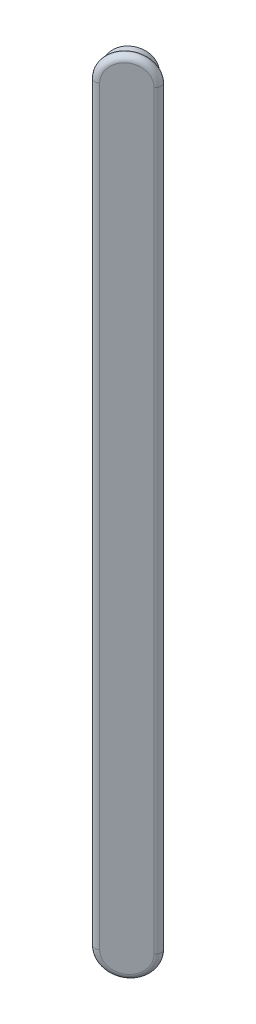
from build123d import *

# Parameters (mm, degrees)
BOSS_EXTRUDE1_DEPTH = 1.499997834
BOSS_EXTRUDE2_DEPTH = 2.999998821
CUT_EXTRUDE1_DEPTH  = 2.999999995
FILLET1_R           = 1.400201404
BOSS_EXTRUDE3_REACH = 8499.621
SKETCH4_W           = 6.8
SKETCH4_H           = 1


with BuildPart() as part:
    # Sketch1 → Boss-Extrude1 (new body)
    with BuildSketch(Plane(origin=(-3679.783466787, -3e-09, -4864.000529017), x_dir=(0, -1, 0), z_dir=(-0.6033298825291362, -4.862971078225009e-13, -0.7974917258801991))):
        with BuildLine():
            Line((-531.630972559, 8466.305810109), (-709.630972559, 8466.305810109))
            ThreePointArc((-709.630972559, 8466.305810109), (-713.873613004, 8464.548451039), (-715.630972559, 8460.305810795))
            ThreePointArc((-715.630972559, 8460.305810795), (-713.873613489, 8456.063169664), (-709.630972559, 8454.305810109))
            Line((-709.630972559, 8454.305810109), (-531.630972559, 8454.305810109))
            ThreePointArc((-531.630972559, 8454.305810109), (-525.630972559, 8460.305810109), (-531.630972559, 8466.305810109))
        make_face()
    extrude(amount=-BOSS_EXTRUDE1_DEPTH)

    # Sketch2 → Boss-Extrude2 (add)
    with BuildSketch(Plane(origin=(-3679.783466787, -3e-09, -4864.000529017), x_dir=(-0.7974917258801992, 3.679004651903849e-13, 0.6033298825291362), z_dir=(-0.6033298825291362, -4.862971078225007e-13, -0.7974917258801992))):
        with BuildLine():
            Line((8455.40581011, 531.630972551), (8455.40581011, 709.630972551))
            ThreePointArc((8455.40581011, 709.630972551), (8456.840986746, 713.095795642), (8460.305809725, 714.530972551))
            ThreePointArc((8460.305809725, 714.530972551), (8463.770633201, 713.095795914), (8465.20581011, 709.630972551))
            Line((8465.20581011, 709.630972551), (8465.20581011, 531.630972551))
            ThreePointArc((8465.20581011, 531.630972551), (8460.30581011, 526.730972551), (8455.40581011, 531.630972551))
        make_face()
    extrude(amount=BOSS_EXTRUDE2_DEPTH)

    # Sketch3 → Cut-Extrude1 (cut)
    with BuildSketch(Plane(origin=(-3681.593455723, -3e-09, -4866.393003255), x_dir=(-0.7974917258801991, 3.6790046519038474e-13, 0.6033298825291363), z_dir=(-0.6033298825291363, -4.862971078225009e-13, -0.7974917258801992))):
        with BuildLine():
            Line((8463.705809388, 531.630972551), (8463.705809388, 709.630972551))
            ThreePointArc((8463.705809388, 709.630972551), (8462.709972444, 712.035135607), (8460.305809388, 713.030972551))
            ThreePointArc((8460.305809388, 713.030972551), (8457.901646332, 712.035135607), (8456.905809388, 709.630972551))
            Line((8456.905809388, 709.630972551), (8456.905809388, 531.630972551))
            ThreePointArc((8456.905809388, 531.630972551), (8460.305809388, 528.230972551), (8463.705809388, 531.630972551))
        make_face()
    extrude(amount=-CUT_EXTRUDE1_DEPTH, mode=Mode.SUBTRACT)

    # Fillet1
    fillet1_edges = [part.edges().sort_by_distance(p)[0] for p in [
        (-10422.518884598, 713.87361348, 238.991305657),
        (-10421.117404893, 620.630972551, 237.931038123),
        (-10425.902355248, 525.630972551, 241.551017418),
        (-10430.687305604, 620.630972551, 245.170996713),
    ]]
    fillet(fillet1_edges, radius=FILLET1_R)

    # Sketch4 → Boss-Extrude3 (add, up to next)
    with BuildSketch(Plane(origin=(-3681.593455723, -3e-09, -4866.393003255), x_dir=(-0.7974917258801991, 3.679004651903847e-13, 0.6033298825291363), z_dir=(-0.6033298825291363, -4.862971078225008e-13, -0.7974917258801992)), mode=Mode.PRIVATE) as boss_extrude3_sk1:
        with Locations((8460.305809388, 682.230972551)):
            Rectangle(SKETCH4_W, SKETCH4_H)
    boss_extrude3_tool1 = extrude(boss_extrude3_sk1.sketch, amount=-BOSS_EXTRUDE3_REACH, mode=Mode.PRIVATE) - part.part
    # Sketch4 → Boss-Extrude3 (add, up to next)
    with BuildSketch(Plane(origin=(-3681.593455723, -3e-09, -4866.393003255), x_dir=(-0.7974917258801991, 3.679004651903847e-13, 0.6033298825291363), z_dir=(-0.6033298825291363, -4.862971078225008e-13, -0.7974917258801992)), mode=Mode.PRIVATE) as boss_extrude3_sk2:
        with Locations((8460.305809388, 651.430972551)):
            Rectangle(SKETCH4_W, SKETCH4_H)
    boss_extrude3_tool2 = extrude(boss_extrude3_sk2.sketch, amount=-BOSS_EXTRUDE3_REACH, mode=Mode.PRIVATE) - part.part
    # Sketch4 → Boss-Extrude3 (add, up to next)
    with BuildSketch(Plane(origin=(-3681.593455723, -3e-09, -4866.393003255), x_dir=(-0.7974917258801991, 3.679004651903847e-13, 0.6033298825291363), z_dir=(-0.6033298825291363, -4.862971078225008e-13, -0.7974917258801992)), mode=Mode.PRIVATE) as boss_extrude3_sk3:
        with Locations((8460.305809388, 620.630972551)):
            Rectangle(SKETCH4_W, SKETCH4_H)
    boss_extrude3_tool3 = extrude(boss_extrude3_sk3.sketch, amount=-BOSS_EXTRUDE3_REACH, mode=Mode.PRIVATE) - part.part
    # Sketch4 → Boss-Extrude3 (add, up to next)
    with BuildSketch(Plane(origin=(-3681.593455723, -3e-09, -4866.393003255), x_dir=(-0.7974917258801991, 3.679004651903847e-13, 0.6033298825291363), z_dir=(-0.6033298825291363, -4.862971078225008e-13, -0.7974917258801992)), mode=Mode.PRIVATE) as boss_extrude3_sk4:
        with Locations((8460.305809388, 589.830972551)):
            Rectangle(SKETCH4_W, SKETCH4_H)
    boss_extrude3_tool4 = extrude(boss_extrude3_sk4.sketch, amount=-BOSS_EXTRUDE3_REACH, mode=Mode.PRIVATE) - part.part
    # Sketch4 → Boss-Extrude3 (add, up to next)
    with BuildSketch(Plane(origin=(-3681.593455723, -3e-09, -4866.393003255), x_dir=(-0.7974917258801991, 3.679004651903847e-13, 0.6033298825291363), z_dir=(-0.6033298825291363, -4.862971078225008e-13, -0.7974917258801992)), mode=Mode.PRIVATE) as boss_extrude3_sk5:
        with Locations((8460.305809388, 559.030972551)):
            Rectangle(SKETCH4_W, SKETCH4_H)
    boss_extrude3_tool5 = extrude(boss_extrude3_sk5.sketch, amount=-BOSS_EXTRUDE3_REACH, mode=Mode.PRIVATE) - part.part
    add(boss_extrude3_tool1.solids().sort_by_distance((-10428.617337, 682.230973, 237.962307))[0])
    add(boss_extrude3_tool2.solids().sort_by_distance((-10428.617337, 651.430973, 237.962307))[0])
    add(boss_extrude3_tool3.solids().sort_by_distance((-10428.617337, 620.630973, 237.962307))[0])
    add(boss_extrude3_tool4.solids().sort_by_distance((-10428.617337, 589.830973, 237.962307))[0])
    add(boss_extrude3_tool5.solids().sort_by_distance((-10428.617337, 559.030973, 237.962307))[0])


solid = part.part
